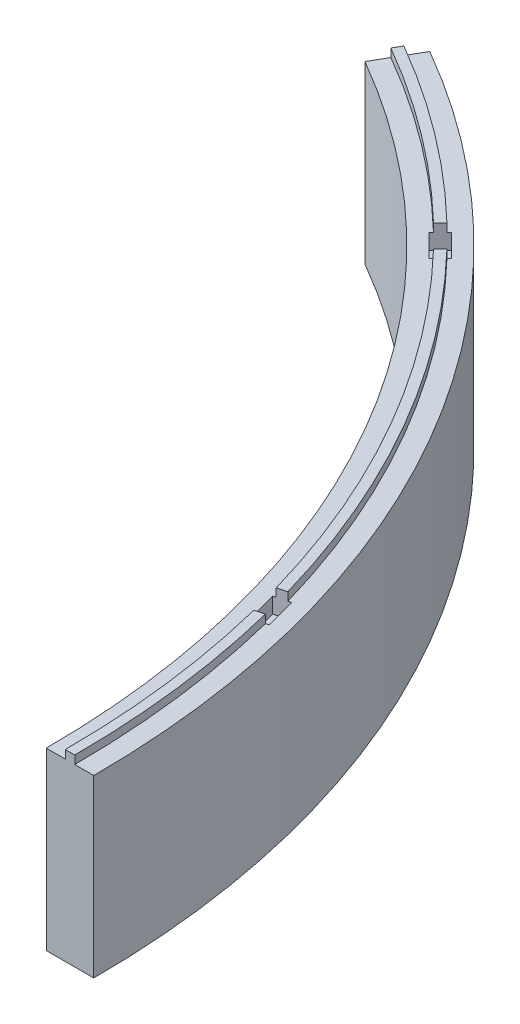
from build123d import *

# Parameters (mm, degrees)
AUFSATZ_LINEAR_AUSTRAGEN1_DEPTH = 55.4
AUFSATZ_LINEAR_AUSTRAGEN2_DEPTH = 2.6
SCHNITT_LINEAR_AUSTRAGEN1_DEPTH = 7.5
SKIZZE4_R                       = 2.2
SCHNITT_LINEAR_AUSTRAGEN2_DEPTH = 10


with BuildPart() as part:
    # Skizze1 → Aufsatz-Linear austragen1 (new body)
    with BuildSketch(Plane(origin=(0, 0, 0), x_dir=(1, 0, 0), z_dir=(0, 1, 0))):
        with BuildLine():
            Line((137.5, 238.156986041), (145, 251.147367097))
            ThreePointArc((145, 251.147367097), (251.147367097, 145), (290, 0))
            Line((290, 0), (275, 0))
            ThreePointArc((275, 0), (238.156986041, 137.5), (137.5, 238.156986041))
        make_face()
    extrude(amount=AUFSATZ_LINEAR_AUSTRAGEN1_DEPTH)

    # Skizze2 → Aufsatz-Linear austragen2 (add)
    with BuildSketch(Plane(origin=(0, 55.4, 0), x_dir=(1, 0, 0), z_dir=(0, 1, 0))):
        with BuildLine():
            Line((140.5, 243.353138463), (142, 245.951214675))
            ThreePointArc((142, 245.951214675), (245.951214675, 142), (284, 0))
            Line((284, 0), (281, 0))
            ThreePointArc((281, 0), (243.353138463, 140.5), (140.5, 243.353138463))
        make_face()
    extrude(amount=AUFSATZ_LINEAR_AUSTRAGEN2_DEPTH)

    # Skizze3 → Schnitt-Linear austragen1 (cut)
    with BuildSketch(Plane(origin=(0, 58, 0), x_dir=(1, 0, 0), z_dir=(0, 1, 0))):
        Polygon((269.165136135, 77.29896176), (273.994765267, 78.593056986), (276.582955718, 68.933798723), (271.753326586, 67.639703497), align=None)
        Polygon((194.454364826, 201.525432638), (197.989898732, 205.060966544), (205.060966544, 197.989898732), (201.525432638, 194.454364826), align=None)
    extrude(amount=-SCHNITT_LINEAR_AUSTRAGEN1_DEPTH, mode=Mode.SUBTRACT)

    # Skizze4 → Schnitt-Linear austragen2 (cut)
    with BuildSketch(Plane.XZ):
        with Locations(Location((199.757665685, -199.757665685, 0), (0, 0, 270))):
            Circle(SKIZZE4_R)
        with Locations(Location((272.874045927, -73.116380241, 0), (0, 0, 270))):
            Circle(SKIZZE4_R)
    extrude(amount=-SCHNITT_LINEAR_AUSTRAGEN2_DEPTH, mode=Mode.SUBTRACT)


solid = part.part
